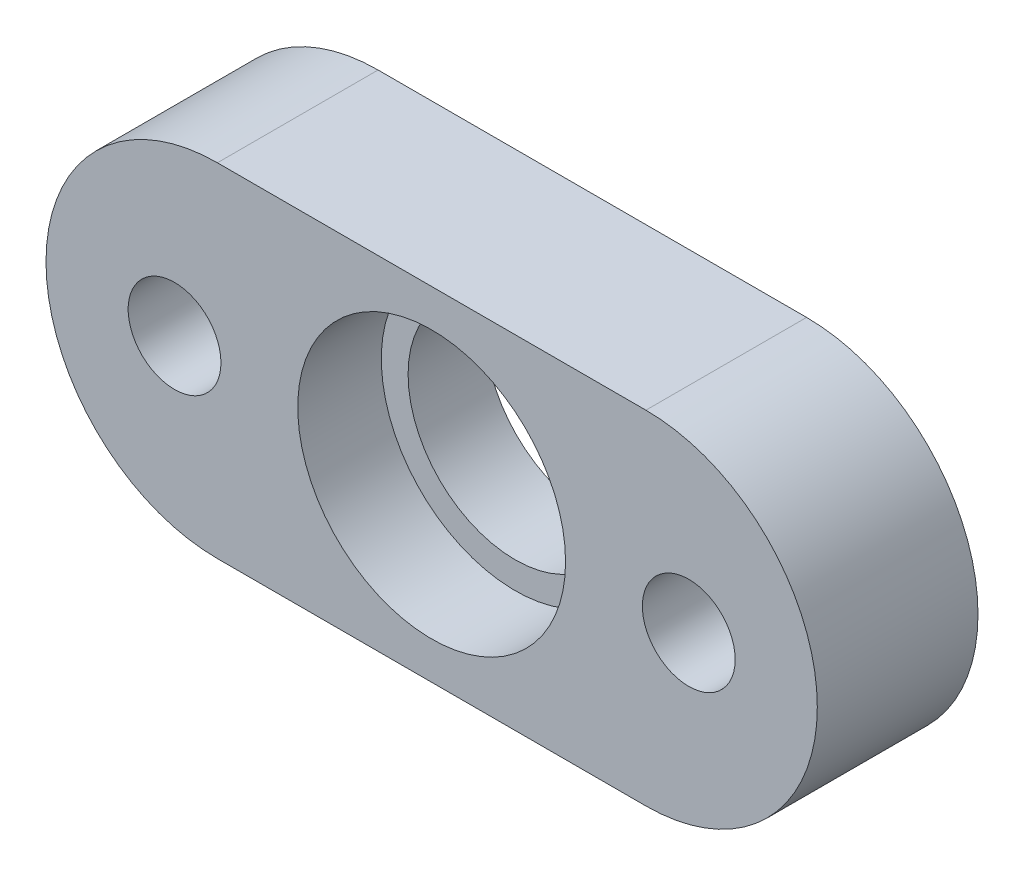
from build123d import *

# Parameters (mm, degrees)
BOSS_EXTRUDE5_DEPTH = 9.525
SKETCH5_R           = 7.9375
CUT_EXTRUDE3_DEPTH  = 4.953
SKETCH6_R           = 6.35
SKETCH6_R_2         = 2.75
CUT_EXTRUDE4_DEPTH  = 27.768093414


with BuildPart() as part:
    # Sketch2 → Boss-Extrude5 (new body)
    with BuildSketch(Plane.XY):
        with BuildLine():
            Line((-12.7, 10.16), (12.7, 10.16))
            ThreePointArc((12.7, 10.16), (22.86, 0), (12.7, -10.16))
            Line((12.7, -10.16), (-12.7, -10.16))
            ThreePointArc((-12.7, -10.16), (-22.86, 0), (-12.7, 10.16))
        make_face()
    extrude(amount=BOSS_EXTRUDE5_DEPTH)

    # Sketch5 → Cut-Extrude3 (cut)
    with BuildSketch(Plane.XY.offset(9.525)):
        Circle(SKETCH5_R)
    extrude(amount=-CUT_EXTRUDE3_DEPTH, mode=Mode.SUBTRACT)

    # Sketch6 → Cut-Extrude4 (cut, through all)
    with BuildSketch(Plane.XY.offset(9.525)):
        Circle(SKETCH6_R)
        with Locations((-15.24, 0)):
            Circle(SKETCH6_R_2)
        with Locations((15.24, 0)):
            Circle(SKETCH6_R_2)
    extrude(amount=-CUT_EXTRUDE4_DEPTH, mode=Mode.SUBTRACT)


solid = part.part
